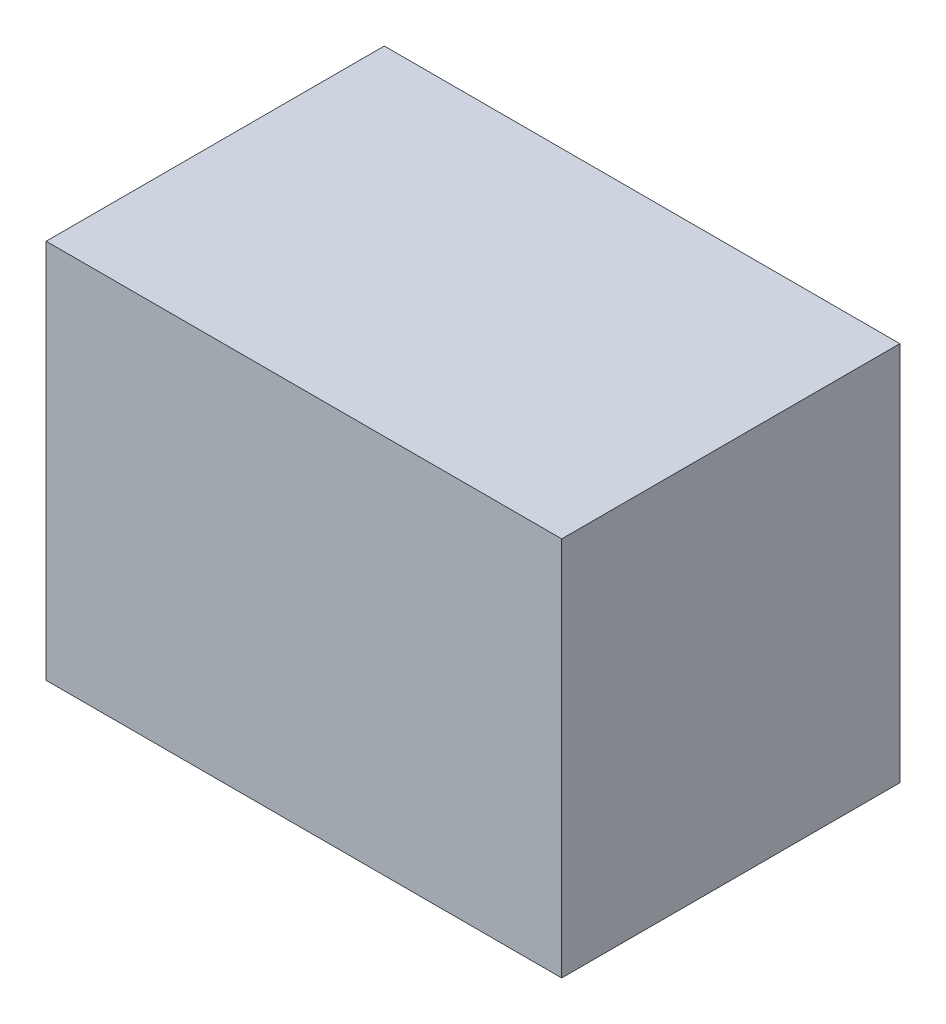
from build123d import *

# Parameters (mm, degrees)
SKETCH1_W           = 16.4592
SKETCH1_H           = 12.1412
BOSS_EXTRUDE1_DEPTH = 10.795
SKETCH2_W           = 2.9972
SKETCH2_H           = 5.461
CUT_EXTRUDE1_DEPTH  = 9.017


with BuildPart() as part:
    # Sketch1 → Boss-Extrude1 (new body)
    with BuildSketch(Plane.XY):
        with Locations((8.2296, 6.0706)):
            Rectangle(SKETCH1_W, SKETCH1_H)
    extrude(amount=BOSS_EXTRUDE1_DEPTH)

    # Sketch2 → Cut-Extrude1 (cut)
    with BuildSketch(Plane.ZY):
        Polygon((1.524, 1.778), (1.524, 10.3632), (7.945751337, 10.3632), (9.652, 8.656951337), (9.652, 3.484248663), (7.945751337, 1.778), align=None)
        with Locations((5.4356, 6.0706)):
            Rectangle(SKETCH2_W, SKETCH2_H, mode=Mode.SUBTRACT)
    extrude(amount=-CUT_EXTRUDE1_DEPTH, mode=Mode.SUBTRACT)


solid = part.part
